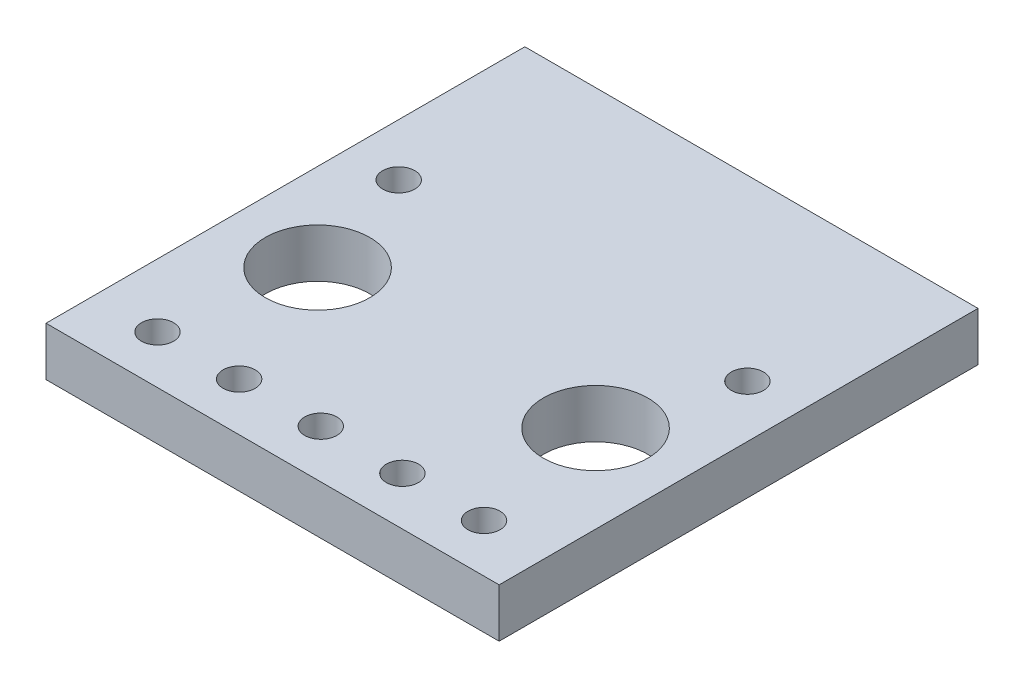
from build123d import *

# Parameters (mm, degrees)
SKETCH1_W           = 14.1
SKETCH1_H           = 14.9
SKETCH1_R           = 1.625
SKETCH1_R_2         = 0.5
BOSS_EXTRUDE1_DEPTH = 1.52


with BuildPart() as part:
    # Sketch1 → Boss-Extrude1 (new body)
    with BuildSketch(Plane(origin=(0, 0, 0), x_dir=(1, 0, 0), z_dir=(0, 1, 0))):
        with Locations((7.05, 7.45)):
            Rectangle(SKETCH1_W, SKETCH1_H)
        with Locations(Location((2.725, 5.725, 0), (0, 0, 270))):
            Circle(SKETCH1_R, mode=Mode.SUBTRACT)
        with Locations(Location((11.375, 5.725, 0), (0, 0, 270))):
            Circle(SKETCH1_R, mode=Mode.SUBTRACT)
        with Locations(Location((1.97, 1.5, 0), (0, 0, 270))):
            Circle(SKETCH1_R_2, mode=Mode.SUBTRACT)
        with Locations(Location((4.51, 1.5, 0), (0, 0, 270))):
            Circle(SKETCH1_R_2, mode=Mode.SUBTRACT)
        with Locations(Location((7.05, 1.5, 0), (0, 0, 270))):
            Circle(SKETCH1_R_2, mode=Mode.SUBTRACT)
        with Locations(Location((9.59, 1.5, 0), (0, 0, 270))):
            Circle(SKETCH1_R_2, mode=Mode.SUBTRACT)
        with Locations(Location((12.13, 1.5, 0), (0, 0, 270))):
            Circle(SKETCH1_R_2, mode=Mode.SUBTRACT)
        with Locations(Location((1.625, 9.35, 0), (0, 0, 270))):
            Circle(SKETCH1_R_2, mode=Mode.SUBTRACT)
        with Locations(Location((12.475, 9.35, 0), (0, 0, 270))):
            Circle(SKETCH1_R_2, mode=Mode.SUBTRACT)
    extrude(amount=BOSS_EXTRUDE1_DEPTH)


solid = part.part
